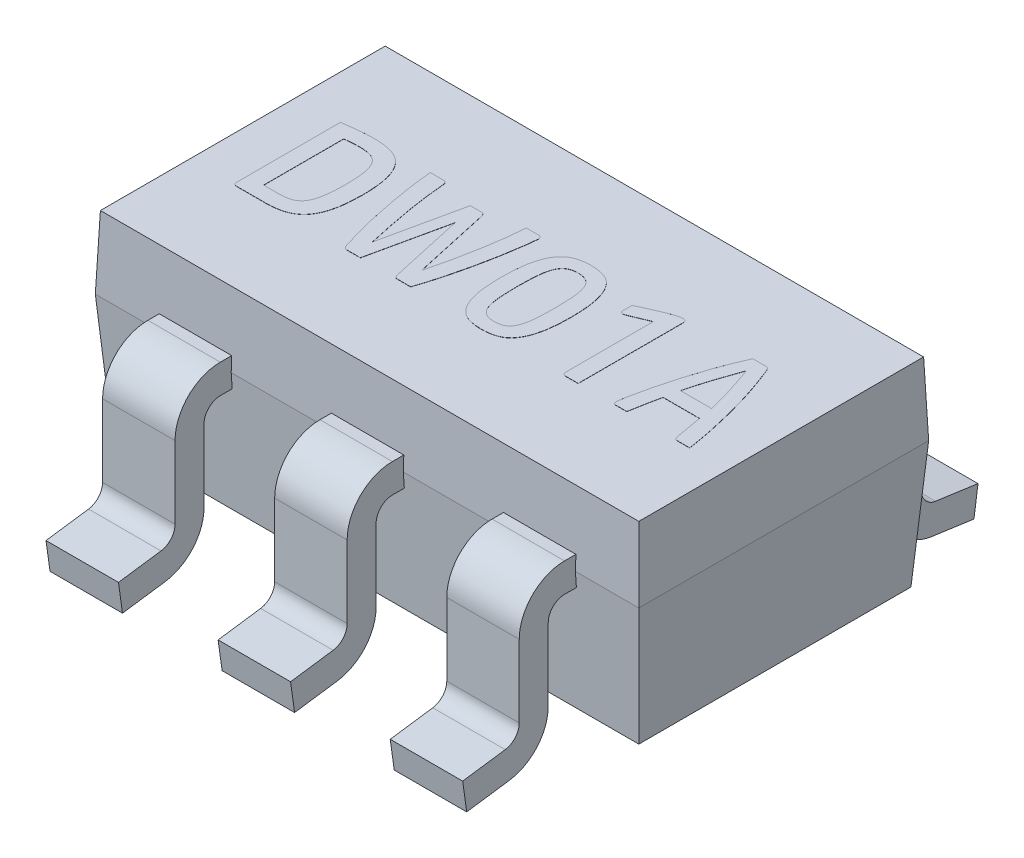
from build123d import *

# Parameters (mm, degrees)
SKETCH1_W                = 3
SKETCH1_H                = 1.6
EXTRUDE1_DEPTH           = 0.4
EXTRUDE1_TAPER           = 2
EXTRUDE1_OTHER_WAY_DEPTH = 0.7
EXTRUDE1_OTHER_WAY_TAPER = 4
EXTRUDE3_DEPTH           = 0.2
LPATTERN3_COUNT          = 3
LPATTERN3_PITCH          = 0.95
BOSS_EXTRUDE1_DEPTH      = 0.001


with BuildPart() as part:
    # Sketch1 → Extrude1 (new body)
    with BuildSketch(Plane(origin=(0, 0, 0), x_dir=(1, 0, 0), z_dir=(0, 1, 0))):
        Rectangle(SKETCH1_W, SKETCH1_H)
    extrude(amount=EXTRUDE1_DEPTH, taper=EXTRUDE1_TAPER)

    # Sketch1 → Extrude1 other way (add)
    with BuildSketch(Plane(origin=(0, 0, 0), x_dir=(1, 0, 0), z_dir=(0, 1, 0))):
        Rectangle(SKETCH1_W, SKETCH1_H)
    extrude(amount=-EXTRUDE1_OTHER_WAY_DEPTH, taper=EXTRUDE1_OTHER_WAY_TAPER)

    # Sketch5 → Extrude3 (add, symmetric)
    with BuildSketch(Plane(origin=(0.95, 0, 0), x_dir=(0, 0, -1), z_dir=(1, 0, 0))):
        with BuildLine():
            Line((0, 0.08), (-0.86, 0.08))
            ThreePointArc((-0.86, 0.08), (-1.036776695, 0.006776695), (-1.11, -0.17))
            Line((-1.11, -0.17), (-1.11, -0.56943494))
            ThreePointArc((-1.11, -0.56943494), (-1.132076138, -0.628480253), (-1.187474421, -0.658559066))
            Line((-1.187474421, -0.658559066), (-1.422267696, -0.691557109))
            Line((-1.422267696, -0.691557109), (-1.4, -0.85))
            Line((-1.4, -0.85), (-1.165206725, -0.817001957))
            ThreePointArc((-1.165206725, -0.817001957), (-1.011322605, -0.733449697), (-0.95, -0.56943494))
            Line((-0.95, -0.56943494), (-0.95, -0.17))
            ThreePointArc((-0.95, -0.17), (-0.92363961, -0.10636039), (-0.86, -0.08))
            Line((-0.86, -0.08), (0, -0.08))
            Line((0, -0.08), (0.86, -0.08))
            ThreePointArc((0.86, -0.08), (0.92363961, -0.10636039), (0.95, -0.17))
            Line((0.95, -0.17), (0.95, -0.56943494))
            ThreePointArc((0.95, -0.56943494), (1.011322605, -0.733449697), (1.165206725, -0.817001957))
            Line((1.165206725, -0.817001957), (1.4, -0.85))
            Line((1.4, -0.85), (1.422267696, -0.691557109))
            Line((1.422267696, -0.691557109), (1.187474421, -0.658559066))
            ThreePointArc((1.187474421, -0.658559066), (1.132076138, -0.628480253), (1.11, -0.56943494))
            Line((1.11, -0.56943494), (1.11, -0.17))
            ThreePointArc((1.11, -0.17), (1.036776695, 0.006776695), (0.86, 0.08))
            Line((0.86, 0.08), (0, 0.08))
        make_face()
    extrude3 = extrude(amount=EXTRUDE3_DEPTH, both=True)

    # LPattern3: Extrude3 ×3
    with Locations(*[(-i * LPATTERN3_PITCH, 0, 0) for i in range(1, LPATTERN3_COUNT)]):
        add(extrude3)

    # Sketch6 → Boss-Extrude1 (add)
    # profile 1 of 5: a face of its own
    with BuildSketch(Plane(origin=(0, 0.4, 0), x_dir=(1, 0, 0), z_dir=(0, 1, 0))):
        with BuildLine():
            add(Edge.make_bspline(
                [(-1.223375, -0.295031814), (-1.226425285, -0.294859663), (-1.231994706, -0.294545338), (-1.239306934, -0.290562221), (-1.243555824, -0.283460399), (-1.243843157, -0.278008024), (-1.244, -0.275031814)],
                knots=[0, 0, 0, 0, 1.108665178, 2.024277004, 2.921540092, 4, 4, 4, 4], degree=3))
            Line((-1.244, -0.275031814), (-1.244, 0.296968186))
            add(Edge.make_bspline(
                [(-1.244, 0.296968186), (-1.237171313, 0.298082206), (-1.223078435, 0.300381292), (-1.20127323, 0.303319509), (-1.178563414, 0.306036258), (-1.155398985, 0.308439598), (-1.13234399, 0.310245035), (-1.109804629, 0.311757985), (-1.088219369, 0.312869262), (-1.074167945, 0.312935948), (-1.067375, 0.312968186)],
                knots=[0, 0, 0, 0, 0.935376032, 1.930406455, 2.974290472, 4.027510672, 5.078680102, 6.100520458, 7.08172577, 8, 8, 8, 8], degree=3))
            add(Edge.make_bspline(
                [(-1.067375, 0.312968186), (-1.057575824, 0.312780789), (-1.038682632, 0.312419478), (-1.011378207, 0.309532493), (-0.986204273, 0.304764872), (-0.963098077, 0.297876137), (-0.94187564, 0.288923297), (-0.922777234, 0.277173663), (-0.905507254, 0.263016469), (-0.890292775, 0.246171729), (-0.876921256, 0.226736984), (-0.865720794, 0.204429065), (-0.856183288, 0.179448169), (-0.850189967, 0.156618414), (-0.846133253, 0.137015185), (-0.84335234, 0.12126678), (-0.841144962, 0.104703965), (-0.839279157, 0.087322853), (-0.83775353, 0.069112341), (-0.836808085, 0.050059362), (-0.836161845, 0.030222577), (-0.836054603, 0.016718727), (-0.836, 0.009843186)],
                knots=[0, 0, 0, 0, 1.328772842, 2.561925806, 3.718976462, 4.798820616, 5.82652491, 6.833511663, 7.8291285, 8.845223298, 9.901718166, 11.018803696, 12.222589634, 13.522141222, 14.21483074, 14.937638865, 15.690484759, 16.480545211, 17.308384882, 18.168537763, 19.067503476, 20, 20, 20, 20], degree=3))
            add(Edge.make_bspline(
                [(-0.836, 0.009843186), (-0.836054618, 0.002967648), (-0.836161889, -0.010536198), (-0.836807919, -0.030373013), (-0.837754115, -0.049425884), (-0.839277103, -0.067636779), (-0.841156533, -0.085057603), (-0.843338663, -0.10166587), (-0.846138738, -0.117452177), (-0.850160751, -0.13702486), (-0.856312235, -0.159766854), (-0.865399297, -0.18490688), (-0.876644359, -0.207188471), (-0.889345223, -0.2269461), (-0.904167199, -0.244011044), (-0.921120473, -0.258302011), (-0.939897806, -0.270418194), (-0.960906969, -0.279557011), (-0.983781054, -0.286563714), (-1.008659468, -0.291483253), (-1.035633384, -0.294511392), (-1.054324922, -0.294854312), (-1.064, -0.295031814)],
                knots=[0, 0, 0, 0, 0.935902873, 1.838152449, 2.701447412, 3.532311128, 4.325257619, 5.086473708, 5.811922204, 6.507142072, 7.805966407, 9.015466938, 10.139126535, 11.19626005, 12.205205032, 13.203041318, 14.205284504, 15.236103397, 16.310696409, 17.45638425, 18.683378425, 20, 20, 20, 20], degree=3))
            Line((-1.064, -0.295031814), (-1.223375, -0.295031814))
        make_face()
        with BuildLine():
            add(Edge.make_bspline(
                [(-1.07375, 0.232968186), (-1.080585917, 0.232911567), (-1.095020607, 0.23279201), (-1.113215297, 0.231485223), (-1.128011981, 0.230436522), (-1.138292452, 0.22935824), (-1.147530332, 0.228491265), (-1.153295573, 0.227539603), (-1.156, 0.227093186)],
                knots=[0, 0, 0, 0, 1.490676049, 3.147704419, 3.977152633, 4.72590411, 5.402332237, 6, 6, 6, 6], degree=3))
            Line((-1.156, 0.227093186), (-1.156, -0.215031814))
            Line((-1.156, -0.215031814), (-1.075375, -0.215031814))
            add(Edge.make_bspline(
                [(-1.075375, -0.215031814), (-1.069496653, -0.214941834), (-1.058094701, -0.214767304), (-1.041554557, -0.213253514), (-1.026173306, -0.210785866), (-1.011876137, -0.207364113), (-0.998607789, -0.202473057), (-0.986705665, -0.195151232), (-0.975966504, -0.185895369), (-0.966311323, -0.174547518), (-0.957867781, -0.160826048), (-0.950860976, -0.144528675), (-0.944896179, -0.125765313), (-0.940964868, -0.108419959), (-0.9384079, -0.093142694), (-0.936613326, -0.080520971), (-0.935343831, -0.06695523), (-0.933999781, -0.052549822), (-0.933240047, -0.037200801), (-0.932393589, -0.020956772), (-0.932082632, -0.003782975), (-0.93202793, 0.007968206), (-0.932, 0.013968186)],
                knots=[0, 0, 0, 0, 1.119126313, 2.170716364, 3.15939933, 4.083039955, 4.967088592, 5.839273634, 6.728221659, 7.656756138, 8.665107533, 9.784036968, 11.026011415, 12.409807349, 13.166317954, 13.97530083, 14.83659221, 15.760335054, 16.729859669, 17.76236126, 18.857494575, 20, 20, 20, 20], degree=3))
            add(Edge.make_bspline(
                [(-0.932, 0.013968186), (-0.932119118, 0.024426875), (-0.932347003, 0.044435436), (-0.933416917, 0.072974421), (-0.935887917, 0.098607438), (-0.938879525, 0.121458046), (-0.942941374, 0.141846696), (-0.948292486, 0.159881496), (-0.954692804, 0.17581677), (-0.962541581, 0.189478188), (-0.971441244, 0.201231276), (-0.981835233, 0.210892541), (-0.993665337, 0.218489818), (-1.006878216, 0.224143288), (-1.021492021, 0.227967952), (-1.037464514, 0.231101672), (-1.055098826, 0.232552013), (-1.067373494, 0.232825904), (-1.07375, 0.232968186)],
                knots=[0, 0, 0, 0, 1.646369515, 3.149676312, 4.493381991, 5.69822069, 6.776076696, 7.761694412, 8.655661044, 9.472386985, 10.234546276, 10.967798621, 11.69365178, 12.436838391, 13.219710186, 14.067370194, 14.996027848, 16, 16, 16, 16], degree=3))
        make_face(mode=Mode.SUBTRACT)
    # profile 2 of 5: a face of its own
    with BuildSketch(Plane(origin=(0, 0.4, 0), x_dir=(1, 0, 0), z_dir=(0, 1, 0))):
        with BuildLine():
            add(Edge.make_bspline(
                [(-0.425375, 0.256968186), (-0.422793867, 0.25674976), (-0.417758177, 0.256323618), (-0.411493142, 0.251497325), (-0.407317536, 0.244556611), (-0.406130153, 0.239109179), (-0.4055, 0.236218186)],
                knots=[0, 0, 0, 0, 0.968072963, 1.888672581, 2.879502641, 4, 4, 4, 4], degree=3))
            Line((-0.4055, 0.236218186), (-0.312, -0.187656814))
            add(Edge.make_bspline(
                [(-0.312, -0.187656814), (-0.307020784, -0.16763028), (-0.297039455, -0.127485123), (-0.283149408, -0.06677903), (-0.270304448, -0.005429779), (-0.258396973, 0.05647623), (-0.247797454, 0.118648137), (-0.238593022, 0.18085205), (-0.2311917, 0.242922177), (-0.227559826, 0.284332632), (-0.22575, 0.304968186)],
                knots=[0, 0, 0, 0, 0.989128387, 1.982805135, 2.984764598, 3.993372048, 5.004319936, 6.00756839, 7.007136442, 8, 8, 8, 8], degree=3))
            Line((-0.22575, 0.304968186), (-0.15825, 0.304968186))
            add(Edge.make_bspline(
                [(-0.15825, 0.304968186), (-0.156702318, 0.304894906), (-0.153779418, 0.30475651), (-0.149735619, 0.30377787), (-0.146303539, 0.302133325), (-0.143587746, 0.299652987), (-0.141589945, 0.29649453), (-0.140336307, 0.292680563), (-0.139703421, 0.288235948), (-0.139896376, 0.285052706), (-0.14, 0.283343186)],
                knots=[0, 0, 0, 0, 1.123956424, 2.122666227, 3.002809187, 3.860265593, 4.758961615, 5.687756205, 6.758239443, 8, 8, 8, 8], degree=3))
            add(Edge.make_bspline(
                [(-0.14, 0.283343186), (-0.140314519, 0.279299824), (-0.140944155, 0.271205424), (-0.142268558, 0.258710874), (-0.143861434, 0.245142574), (-0.144846241, 0.235594629), (-0.145375, 0.230468186)],
                knots=[0, 0, 0, 0, 0.915597879, 1.83293387, 2.836467985, 4, 4, 4, 4], degree=3))
            add(Edge.make_bspline(
                [(-0.145375, 0.230468186), (-0.146661047, 0.221175789), (-0.149303412, 0.202083234), (-0.153472211, 0.172765691), (-0.158421765, 0.142114921), (-0.165635713, 0.099071685), (-0.175691841, 0.043418229), (-0.190023695, -0.024515652), (-0.205829335, -0.093507115), (-0.223667994, -0.162255901), (-0.242669597, -0.229636862), (-0.257058846, -0.273494545), (-0.264125, -0.295031814)],
                knots=[0, 0, 0, 0, 0.521620081, 1.071742754, 1.646511405, 2.247927122, 3.498518914, 4.790783784, 6.108118113, 7.433708297, 8.739766668, 10, 10, 10, 10], degree=3))
            Line((-0.264125, -0.295031814), (-0.336, -0.295031814))
            add(Edge.make_bspline(
                [(-0.336, -0.295031814), (-0.338897638, -0.294875899), (-0.344239766, -0.294588452), (-0.351286237, -0.29015847), (-0.35553144, -0.282564747), (-0.357111731, -0.27670214), (-0.358, -0.273406814)],
                knots=[0, 0, 0, 0, 1.009142066, 1.860468699, 2.797385982, 4, 4, 4, 4], degree=3))
            Line((-0.358, -0.273406814), (-0.448, 0.134843186))
            Line((-0.448, 0.134843186), (-0.54175, -0.295031814))
            Line((-0.54175, -0.295031814), (-0.613, -0.295031814))
            add(Edge.make_bspline(
                [(-0.613, -0.295031814), (-0.61479807, -0.295007371), (-0.618169061, -0.294961547), (-0.622728208, -0.294041298), (-0.626551404, -0.292905239), (-0.630586785, -0.290107097), (-0.634362269, -0.284218074), (-0.636751888, -0.279019178), (-0.638125, -0.276031814)],
                knots=[0, 0, 0, 0, 0.936593988, 1.755910621, 2.423344838, 3.002689185, 4.277699803, 6, 6, 6, 6], degree=3))
            add(Edge.make_bspline(
                [(-0.638125, -0.276031814), (-0.641467578, -0.265797636), (-0.648293379, -0.24489866), (-0.657801372, -0.212487443), (-0.667627482, -0.178625347), (-0.680338561, -0.130858385), (-0.695342416, -0.06901265), (-0.711634351, 0.006848974), (-0.725986254, 0.083691928), (-0.736525242, 0.147719745), (-0.743922609, 0.198177087), (-0.748666595, 0.234765991), (-0.75269418, 0.270230916), (-0.75490922, 0.293506362), (-0.756, 0.304968186)],
                knots=[0, 0, 0, 0, 0.652521652, 1.332499175, 2.047120565, 2.789598928, 4.328286708, 5.903962882, 7.491975209, 9.065960492, 9.836712452, 10.582879782, 11.302149462, 12, 12, 12, 12], degree=3))
            Line((-0.756, 0.304968186), (-0.682625, 0.304968186))
            add(Edge.make_bspline(
                [(-0.682625, 0.304968186), (-0.679890096, 0.304749487), (-0.674725608, 0.304336503), (-0.668021208, 0.299836383), (-0.663873099, 0.292406464), (-0.663149639, 0.286568228), (-0.66275, 0.283343186)],
                knots=[0, 0, 0, 0, 0.988172293, 1.866026775, 2.821193056, 4, 4, 4, 4], degree=3))
            add(Edge.make_bspline(
                [(-0.66275, 0.283343186), (-0.66105981, 0.264207916), (-0.657663838, 0.225760865), (-0.650688192, 0.167960115), (-0.642323323, 0.109741071), (-0.629159768, 0.031233113), (-0.61014322, -0.067785942), (-0.592761365, -0.146902784), (-0.584, -0.186781814)],
                knots=[0, 0, 0, 0, 0.724754435, 1.456194283, 2.196327218, 2.943770449, 4.459500323, 6, 6, 6, 6], degree=3))
            Line((-0.584, -0.186781814), (-0.48725, 0.256968186))
            Line((-0.48725, 0.256968186), (-0.425375, 0.256968186))
        make_face()
    # profile 3 of 5: a face of its own
    with BuildSketch(Plane(origin=(0, 0.4, 0), x_dir=(1, 0, 0), z_dir=(0, 1, 0))):
        with BuildLine():
            add(Edge.make_bspline(
                [(-0.06, 0.000968186), (-0.059946617, 0.0084271), (-0.059842217, 0.023014169), (-0.05918532, 0.044391418), (-0.05827939, 0.064739236), (-0.056649768, 0.084059859), (-0.055098529, 0.102393516), (-0.052551702, 0.119696779), (-0.050081522, 0.13603551), (-0.045922981, 0.155981746), (-0.039989822, 0.178933719), (-0.031179312, 0.203969736), (-0.021019592, 0.226015805), (-0.009049974, 0.244841726), (0.004317242, 0.260776433), (0.018879222, 0.27409269), (0.034827934, 0.284646094), (0.052139885, 0.29236584), (0.070540065, 0.298125511), (0.090082745, 0.301979038), (0.110677048, 0.304640122), (0.12478271, 0.304857145), (0.132, 0.304968186)],
                knots=[0, 0, 0, 0, 1.085915512, 2.123677079, 3.113655991, 4.050680862, 4.946445563, 5.791476721, 6.596293287, 7.35174689, 8.756917613, 10.044336603, 11.211191252, 12.283140136, 13.281981863, 14.231122299, 15.14639335, 16.053080547, 16.981663225, 17.947693025, 18.949918421, 20, 20, 20, 20], degree=3))
            add(Edge.make_bspline(
                [(0.132, 0.304968186), (0.139215581, 0.304843447), (0.15331298, 0.304599739), (0.173877488, 0.302137303), (0.193341252, 0.298315151), (0.211786747, 0.292885396), (0.229090827, 0.285273729), (0.245143743, 0.275027023), (0.259504154, 0.261802973), (0.272697504, 0.246101368), (0.284364068, 0.227391519), (0.294733407, 0.205643449), (0.303468533, 0.180622815), (0.309542537, 0.157691355), (0.313796632, 0.137699454), (0.31653817, 0.121307643), (0.318702655, 0.103862198), (0.32077666, 0.085373109), (0.322238708, 0.06577652), (0.323198945, 0.045100881), (0.323838657, 0.023388773), (0.323945426, 0.008551982), (0.324, 0.000968186)],
                knots=[0, 0, 0, 0, 1.048884602, 2.049252152, 3.007039148, 3.930993948, 4.839683002, 5.747300714, 6.686800819, 7.667430196, 8.721430359, 9.884084828, 11.16432777, 12.569452303, 13.331211697, 14.136092186, 14.985363755, 15.887361489, 16.841442185, 17.842396784, 18.897145607, 20, 20, 20, 20], degree=3))
            add(Edge.make_bspline(
                [(0.324, 0.000968186), (0.323945411, -0.006615607), (0.323838615, -0.021452395), (0.3231991, -0.043164528), (0.322238169, -0.063840078), (0.320778527, -0.083436975), (0.318691631, -0.101966076), (0.316549823, -0.11945609), (0.313795898, -0.135888078), (0.30954096, -0.155879349), (0.303493951, -0.178778519), (0.29471136, -0.20374225), (0.284329624, -0.225475258), (0.272729863, -0.244265598), (0.259542742, -0.259995002), (0.245100289, -0.27308327), (0.22909608, -0.283343299), (0.211785314, -0.290947403), (0.193341654, -0.296379233), (0.173877374, -0.300200801), (0.15331301, -0.3026634), (0.139215591, -0.302907086), (0.132, -0.303031814)],
                knots=[0, 0, 0, 0, 1.102778508, 2.157454756, 3.158340482, 4.11235553, 5.0142912, 5.869513371, 6.674338479, 7.436045458, 8.841073307, 10.115523257, 11.278097726, 12.337150531, 13.317712434, 14.253094745, 15.160650006, 16.069276535, 16.993167759, 17.950888852, 18.95118757, 20, 20, 20, 20], degree=3))
            add(Edge.make_bspline(
                [(0.132, -0.303031814), (0.124784281, -0.302907881), (0.110686611, -0.302665747), (0.090083399, -0.300187187), (0.070573329, -0.29639301), (0.052119092, -0.290974149), (0.034875395, -0.283311607), (0.018883165, -0.273056028), (0.004327105, -0.259970978), (-0.009085925, -0.244275555), (-0.021016859, -0.225580112), (-0.031153363, -0.203694052), (-0.040034044, -0.178805189), (-0.045946683, -0.155882923), (-0.050064215, -0.135887525), (-0.052577355, -0.119430717), (-0.055083626, -0.101996436), (-0.056665397, -0.083416471), (-0.058271024, -0.06384358), (-0.059189639, -0.04316352), (-0.059841161, -0.021452666), (-0.059946272, -0.006615699), (-0.06, 0.000968186)],
                knots=[0, 0, 0, 0, 1.048159595, 2.047835674, 3.010898863, 3.934215009, 4.836747781, 5.743738133, 6.683057347, 7.670834622, 8.735720855, 9.894965334, 11.168622, 12.571220812, 13.331224489, 14.134567984, 14.990051056, 15.890204215, 16.843625435, 17.843888157, 18.897907919, 20, 20, 20, 20], degree=3))
        make_face()
        with BuildLine():
            add(Edge.make_bspline(
                [(0.028, 0.000968186), (0.02802702, -0.009366119), (0.028078891, -0.029205487), (0.029048396, -0.057706612), (0.030187697, -0.083721954), (0.032007871, -0.107290205), (0.034610921, -0.128570974), (0.037957316, -0.147700607), (0.042550045, -0.1646632), (0.047609642, -0.179693195), (0.054034748, -0.192582823), (0.061446839, -0.203548647), (0.069999688, -0.21260196), (0.079873065, -0.219633989), (0.091002613, -0.224797364), (0.103444185, -0.228367661), (0.117249685, -0.230656482), (0.126948611, -0.230903278), (0.132, -0.231031814)],
                knots=[0, 0, 0, 0, 1.720065586, 3.302109874, 4.746364848, 6.054386797, 7.235504498, 8.31426259, 9.283276999, 10.158500407, 10.94942373, 11.672749217, 12.35458554, 13.010863393, 13.677900617, 14.386716477, 15.159770644, 16, 16, 16, 16], degree=3))
            add(Edge.make_bspline(
                [(0.132, -0.231031814), (0.137051395, -0.23090328), (0.146750332, -0.23065649), (0.160555754, -0.228367633), (0.172997593, -0.224797459), (0.184126219, -0.21963366), (0.194002984, -0.212603186), (0.202542481, -0.203543747), (0.209998988, -0.192618434), (0.216191819, -0.179627581), (0.221539002, -0.164719317), (0.225853488, -0.147670423), (0.229282607, -0.128576974), (0.231869346, -0.107288741), (0.233658345, -0.083635579), (0.234999282, -0.057460836), (0.235908436, -0.028663135), (0.235968607, -0.008615897), (0.236, 0.001843186)],
                knots=[0, 0, 0, 0, 0.837801637, 1.608622177, 2.315390018, 2.980499935, 3.634881571, 4.314747827, 5.035983372, 5.821553091, 6.696573582, 7.661029452, 8.736670631, 9.914375666, 11.218618278, 12.672860793, 14.264158507, 16, 16, 16, 16], degree=3))
            add(Edge.make_bspline(
                [(0.236, 0.001843186), (0.235968106, 0.012177264), (0.235906878, 0.032016195), (0.235001316, 0.060522409), (0.233649682, 0.086529938), (0.231867398, 0.110099617), (0.22929602, 0.131349365), (0.225848351, 0.150355951), (0.221567697, 0.16725116), (0.216164884, 0.181974097), (0.210000144, 0.194808861), (0.202545481, 0.20561944), (0.193960895, 0.214536725), (0.184134085, 0.221587065), (0.172972002, 0.226688756), (0.160594389, 0.230510961), (0.146732463, 0.232534153), (0.137047517, 0.232819481), (0.132, 0.232968186)],
                knots=[0, 0, 0, 0, 1.724888498, 3.311368699, 4.760023882, 6.071713409, 7.25614286, 8.331085074, 9.29431695, 10.161264417, 10.94508052, 11.664709829, 12.343452131, 13.00157013, 13.670477667, 14.383285692, 15.157414714, 16, 16, 16, 16], degree=3))
            add(Edge.make_bspline(
                [(0.132, 0.232968186), (0.126952508, 0.232819465), (0.11726761, 0.232534106), (0.103405354, 0.230511126), (0.091028856, 0.226688207), (0.07986294, 0.221588967), (0.07005018, 0.214529645), (0.061362429, 0.205597963), (0.054080148, 0.194526367), (0.047628941, 0.181668324), (0.042524431, 0.166690591), (0.037977782, 0.149799407), (0.034605665, 0.130759082), (0.032008892, 0.109601558), (0.030182618, 0.086117125), (0.029046548, 0.060101317), (0.028076512, 0.031433537), (0.028026268, 0.011427503), (0.028, 0.000968186)],
                knots=[0, 0, 0, 0, 0.840112208, 1.61196908, 2.322684937, 2.989629159, 3.645815512, 4.322565633, 5.051519069, 5.842332118, 6.710897346, 7.67977665, 8.751563795, 9.925635499, 11.226562608, 12.670616217, 14.259371234, 16, 16, 16, 16], degree=3))
        make_face(mode=Mode.SUBTRACT)
    # profile 4 of 5: a face of its own
    with BuildSketch(Plane(origin=(0, 0.4, 0), x_dir=(1, 0, 0), z_dir=(0, 1, 0))):
        with BuildLine():
            add(Edge.make_bspline(
                [(0.5925, -0.295031814), (0.589442522, -0.294870726), (0.583896313, -0.294578516), (0.576728177, -0.290525419), (0.57241101, -0.283570871), (0.572145748, -0.278140522), (0.572, -0.275156814)],
                knots=[0, 0, 0, 0, 1.115948023, 2.024309312, 2.914455666, 4, 4, 4, 4], degree=3))
            Line((0.572, -0.275156814), (0.572, 0.208218186))
            Line((0.572, 0.208218186), (0.472125, 0.166468186))
            add(Edge.make_bspline(
                [(0.472125, 0.166468186), (0.469603801, 0.165415581), (0.465244085, 0.163595393), (0.459362988, 0.161850103), (0.454972608, 0.16120781), (0.45254257, 0.161040128), (0.4515, 0.160968186)],
                knots=[0, 0, 0, 0, 1.526142235, 2.639040427, 3.4161011, 4, 4, 4, 4], degree=3))
            add(Edge.make_bspline(
                [(0.4515, 0.160968186), (0.44921304, 0.161119336), (0.445029255, 0.161395852), (0.439487969, 0.164456187), (0.436407216, 0.170035486), (0.436144678, 0.174263336), (0.436, 0.176593186)],
                knots=[0, 0, 0, 0, 1.087860346, 1.990141622, 2.892422898, 4, 4, 4, 4], degree=3))
            Line((0.436, 0.176593186), (0.436, 0.226718186))
            Line((0.436, 0.226718186), (0.476375, 0.245593186))
            add(Edge.make_bspline(
                [(0.476375, 0.245593186), (0.48212386, 0.248179083), (0.493282013, 0.253198135), (0.509478513, 0.260433085), (0.524624718, 0.267107366), (0.538754517, 0.27304072), (0.55174868, 0.278613367), (0.563723457, 0.283451105), (0.574622928, 0.287750512), (0.587314928, 0.292386988), (0.601262808, 0.297165395), (0.61595919, 0.301462044), (0.628065741, 0.304247883), (0.635323511, 0.304748905), (0.6385, 0.304968186)],
                knots=[0, 0, 0, 0, 1.309349261, 2.541359092, 3.68463039, 4.747185427, 5.724514318, 6.621309077, 7.429723965, 8.158056224, 9.427968145, 10.490769882, 11.339459349, 12, 12, 12, 12], degree=3))
            add(Edge.make_bspline(
                [(0.6385, 0.304968186), (0.640336115, 0.304888313), (0.643788972, 0.304738108), (0.648541554, 0.303864942), (0.652419839, 0.30203602), (0.656244193, 0.298662977), (0.659507828, 0.292901125), (0.659831557, 0.287765411), (0.66, 0.285093186)],
                knots=[0, 0, 0, 0, 0.987636995, 1.857274413, 2.5784266, 3.260993782, 4.574835295, 6, 6, 6, 6], degree=3))
            Line((0.66, 0.285093186), (0.66, -0.295031814))
            Line((0.66, -0.295031814), (0.5925, -0.295031814))
        make_face()
    # profile 5 of 5: a face of its own
    with BuildSketch(Plane(origin=(0, 0.4, 0), x_dir=(1, 0, 0), z_dir=(0, 1, 0))):
        with BuildLine():
            add(Edge.make_bspline(
                [(1.188625, -0.275031814), (1.186526626, -0.262235657), (1.182408494, -0.237122749), (1.175845121, -0.199957663), (1.169015677, -0.163429686), (1.164344701, -0.139196305), (1.162, -0.127031814)],
                knots=[0, 0, 0, 0, 1.034717983, 2.030670418, 3.011450737, 4, 4, 4, 4], degree=3))
            Line((1.162, -0.127031814), (0.961125, -0.127031814))
            add(Edge.make_bspline(
                [(0.961125, -0.127031814), (0.957919536, -0.141014651), (0.951487474, -0.169072517), (0.943320434, -0.211350502), (0.935729434, -0.253373697), (0.930977724, -0.281236196), (0.928625, -0.295031814)],
                knots=[0, 0, 0, 0, 1.005784219, 2.018199702, 3.018747077, 4, 4, 4, 4], degree=3))
            Line((0.928625, -0.295031814), (0.868375, -0.295031814))
            add(Edge.make_bspline(
                [(0.868375, -0.295031814), (0.865792307, -0.294836555), (0.860948127, -0.294470321), (0.854939346, -0.289715395), (0.852119583, -0.282109791), (0.852043172, -0.276468929), (0.852, -0.273281814)],
                knots=[0, 0, 0, 0, 0.978567456, 1.835431302, 2.777007662, 4, 4, 4, 4], degree=3))
            add(Edge.make_bspline(
                [(0.852, -0.273281814), (0.853049427, -0.264679265), (0.855142316, -0.247523073), (0.85863409, -0.23059615), (0.860375, -0.222156814)],
                knots=[0, 0, 0, 0, 1.002850518, 2, 2, 2, 2], degree=3))
            add(Edge.make_bspline(
                [(0.860375, -0.222156814), (0.863214454, -0.208315997), (0.868841325, -0.180888022), (0.877819775, -0.140285322), (0.887315769, -0.100610838), (0.897363075, -0.061931888), (0.907532998, -0.024239474), (0.918100502, 0.012220469), (0.928573344, 0.047534386), (0.939173184, 0.081629326), (0.949927412, 0.114450813), (0.960661553, 0.146015657), (0.971500911, 0.176185201), (0.98241172, 0.204951143), (0.993125008, 0.232242971), (1.003575694, 0.257974988), (1.013882528, 0.282019317), (1.020695888, 0.297473663), (1.024, 0.304968186)],
                knots=[0, 0, 0, 0, 1.226324893, 2.430175142, 3.60908357, 4.766919125, 5.898637563, 6.997473482, 8.061601161, 9.095646198, 10.096337425, 11.059297024, 11.989320821, 12.878627067, 13.729512762, 14.534061673, 15.289098996, 16, 16, 16, 16], degree=3))
            Line((1.024, 0.304968186), (1.097625, 0.304968186))
            add(Edge.make_bspline(
                [(1.097625, 0.304968186), (1.10026201, 0.304817902), (1.105050208, 0.304545021), (1.111343586, 0.300855937), (1.115495629, 0.294583278), (1.117253108, 0.289644566), (1.11825, 0.286843186)],
                knots=[0, 0, 0, 0, 1.046463199, 1.900134568, 2.808896205, 4, 4, 4, 4], degree=3))
            add(Edge.make_bspline(
                [(1.11825, 0.286843186), (1.121396263, 0.279143398), (1.127975726, 0.263041607), (1.137819759, 0.2377087), (1.148026776, 0.210175265), (1.158787231, 0.180624376), (1.169792932, 0.149122572), (1.180619323, 0.1157667), (1.191383807, 0.080670525), (1.202063236, 0.043950313), (1.212727527, 0.005677082), (1.223077067, -0.033991013), (1.233080341, -0.075088824), (1.242748776, -0.11739265), (1.25221358, -0.160686312), (1.260766252, -0.204841657), (1.268804786, -0.249674504), (1.273592694, -0.279856599), (1.276, -0.295031814)],
                knots=[0, 0, 0, 0, 0.660731812, 1.381721681, 2.158829746, 2.993317714, 3.879924571, 4.809391482, 5.778884251, 6.795941388, 7.847110737, 8.934910772, 10.052373382, 11.206963384, 12.382009508, 13.57250524, 14.779483144, 16, 16, 16, 16], degree=3))
            Line((1.276, -0.295031814), (1.207875, -0.295031814))
            add(Edge.make_bspline(
                [(1.207875, -0.295031814), (1.205314076, -0.29483572), (1.200441025, -0.294462584), (1.194089302, -0.29028601), (1.19008602, -0.283404411), (1.1891437, -0.278004305), (1.188625, -0.275031814)],
                knots=[0, 0, 0, 0, 0.986617682, 1.877383824, 2.831604521, 4, 4, 4, 4], degree=3))
        make_face()
        with BuildLine():
            add(Edge.make_bspline(
                [(1.064, 0.230718186), (1.06040792, 0.22063798), (1.053082547, 0.200081292), (1.042053867, 0.168604624), (1.031013472, 0.135852654), (1.01951978, 0.10197473), (1.008235485, 0.066754206), (0.997464145, 0.030068753), (0.986585387, -0.007918977), (0.979899209, -0.033849105), (0.9765, -0.047031814)],
                knots=[0, 0, 0, 0, 0.881570199, 1.797796842, 2.74759587, 3.728860332, 4.744940827, 5.794076997, 6.87852306, 8, 8, 8, 8], degree=3))
            Line((0.9765, -0.047031814), (1.1485, -0.047031814))
            add(Edge.make_bspline(
                [(1.1485, -0.047031814), (1.145196458, -0.033857605), (1.138704534, -0.007968436), (1.12861421, 0.030110542), (1.118086345, 0.06672206), (1.107353562, 0.101969716), (1.096376108, 0.135870714), (1.085695017, 0.168616421), (1.074960306, 0.200125076), (1.067609198, 0.220643962), (1.064, 0.230718186)],
                knots=[0, 0, 0, 0, 1.122254914, 2.205388263, 3.254771997, 4.269792099, 5.249697385, 6.199068116, 7.11579064, 8, 8, 8, 8], degree=3))
        make_face(mode=Mode.SUBTRACT)
    extrude(amount=BOSS_EXTRUDE1_DEPTH)


solid = part.part
